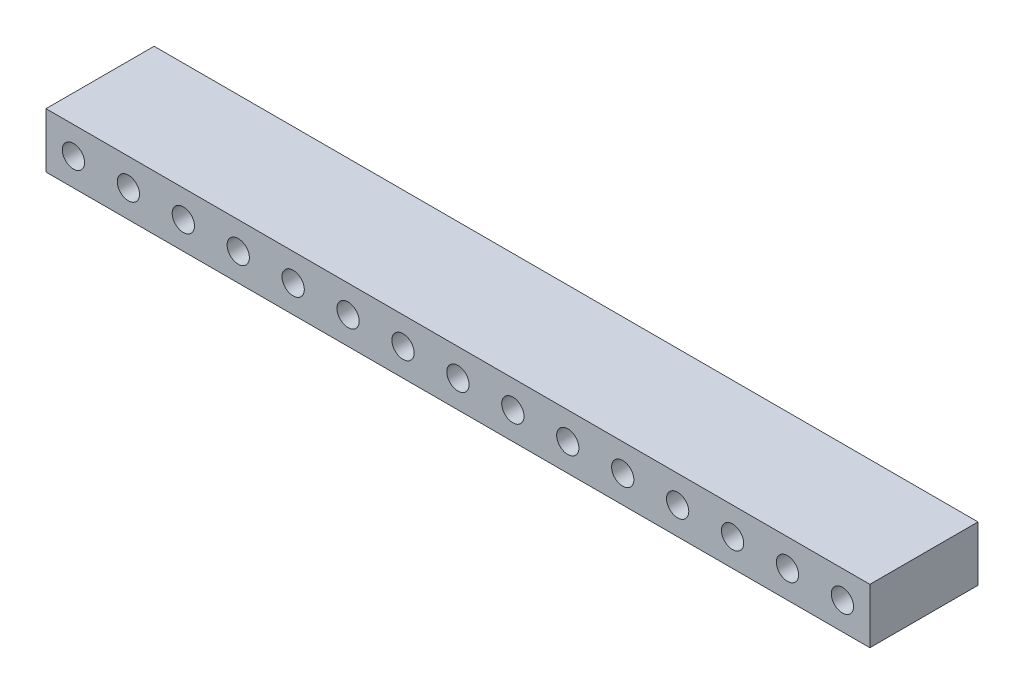
from build123d import *

# Parameters (mm, degrees)
SKETCH1_W           = 38.1
SKETCH1_H           = 2.54
BOSS_EXTRUDE1_DEPTH = 5
SKETCH2_R           = 0.515143842
CUT_EXTRUDE1_DEPTH  = 39.510538817


with BuildPart() as part:
    # Sketch1 → Boss-Extrude1 (new body)
    with BuildSketch(Plane.XY):
        with Locations((19.05, 1.27)):
            Rectangle(SKETCH1_W, SKETCH1_H)
    extrude(amount=BOSS_EXTRUDE1_DEPTH)

    # Sketch2 → Cut-Extrude1 (cut, through all)
    with BuildSketch(Plane.XY.offset(5)):
        with Locations((1.27, 1.27)):
            Circle(SKETCH2_R)
        with Locations((3.81, 1.27)):
            Circle(SKETCH2_R)
        with Locations((6.35, 1.27)):
            Circle(SKETCH2_R)
        with Locations((8.89, 1.27)):
            Circle(SKETCH2_R)
        with Locations((11.43, 1.27)):
            Circle(SKETCH2_R)
        with Locations((13.97, 1.27)):
            Circle(SKETCH2_R)
        with Locations((16.51, 1.27)):
            Circle(SKETCH2_R)
        with Locations((19.05, 1.27)):
            Circle(SKETCH2_R)
        with Locations((21.59, 1.27)):
            Circle(SKETCH2_R)
        with Locations((24.13, 1.27)):
            Circle(SKETCH2_R)
        with Locations((26.67, 1.27)):
            Circle(SKETCH2_R)
        with Locations((29.21, 1.27)):
            Circle(SKETCH2_R)
        with Locations((31.75, 1.27)):
            Circle(SKETCH2_R)
        with Locations((34.29, 1.27)):
            Circle(SKETCH2_R)
        with Locations((36.83, 1.27)):
            Circle(SKETCH2_R)
    extrude(amount=-CUT_EXTRUDE1_DEPTH, mode=Mode.SUBTRACT)


solid = part.part
